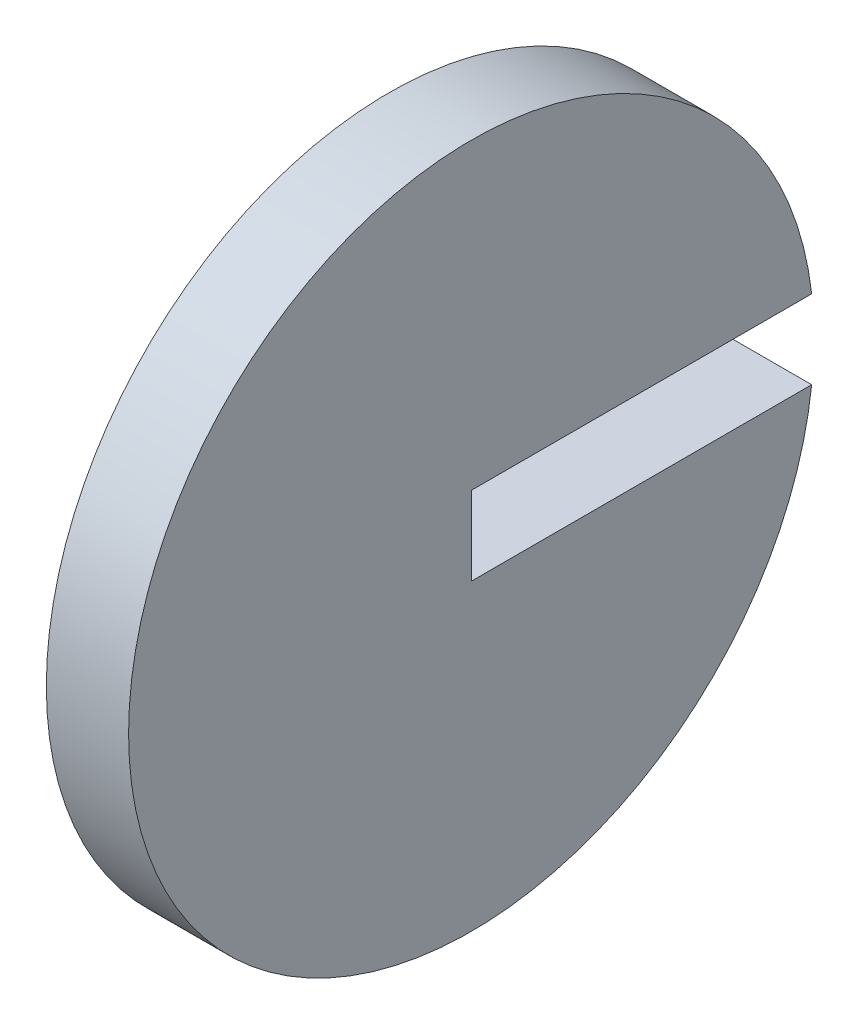
from build123d import *

# Parameters (mm, degrees)
SKETCH1_R           = 12.5
BOSS_EXTRUDE1_DEPTH = 3
SKETCH2_W           = 25
SKETCH2_H           = 2.87
CUT_EXTRUDE1_DEPTH  = 3


with BuildPart() as part:
    # Sketch1 → Boss-Extrude1 (new body)
    with BuildSketch(Plane(origin=(0, 0, 0), x_dir=(0, 0, -1), z_dir=(1, 0, 0))):
        Circle(SKETCH1_R)
    extrude(amount=BOSS_EXTRUDE1_DEPTH)

    # Sketch2 → Cut-Extrude1 (cut)
    with BuildSketch(Plane(origin=(3, 0, 0), x_dir=(0, 0, -1), z_dir=(1, 0, 0))):
        with Locations((12.5, 0)):
            Rectangle(SKETCH2_W, SKETCH2_H)
    extrude(amount=-CUT_EXTRUDE1_DEPTH, mode=Mode.SUBTRACT)


solid = part.part
